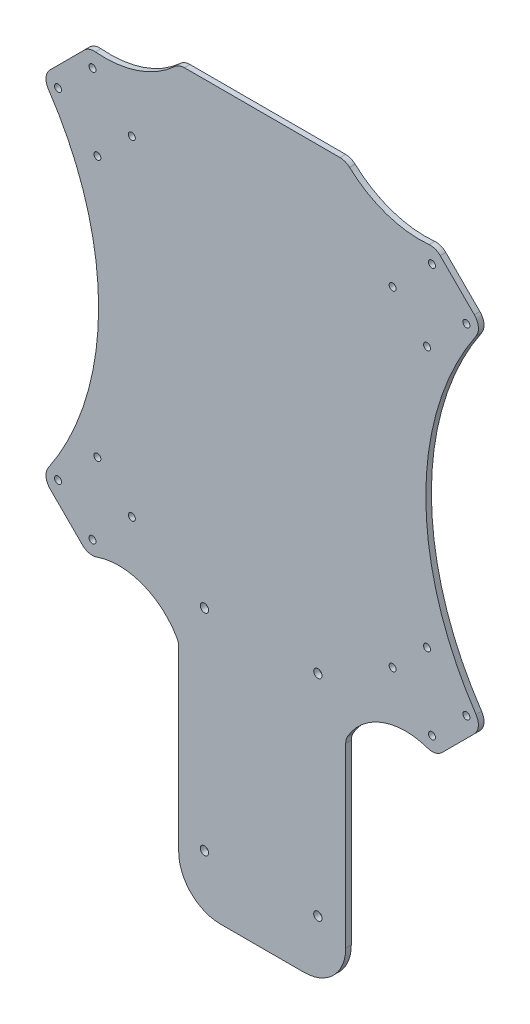
from build123d import *

# Parameters (mm, degrees)
BOSS_EXTRUDE1_DEPTH = 2
SKETCH3_R           = 1.25
F_45_DEGREES_DEPTH  = 188.552659272
SKETCH4_R           = 1.5
CUT_EXTRUDE2_DEPTH  = 188.552659272
FILLET1_R           = 5
FILLET2_R           = 5
FILLET3_R           = 5
FILLET4_R           = 5
FILLET5_R           = 5
FILLET6_R           = 5
FILLET7_R           = 5
FILLET8_R           = 5
FILLET9_R           = 5
FILLET10_R          = 5
FILLET11_R          = 5
FILLET12_R          = 5


with BuildPart() as part:
    # Sketch2 → Boss-Extrude1 (new body)
    with BuildSketch(Plane.XY):
        with BuildLine():
            Line((-79.195959493, 62.225396744), (-62.225396744, 79.195959493))
            ThreePointArc((-62.225396744, 79.195959493), (-44.806778225, 80.702789346), (-30, 90))
            Line((-30, 90), (30, 90))
            ThreePointArc((30, 90), (44.806778225, 80.702789346), (62.225396744, 79.195959493))
            Line((62.225396744, 79.195959493), (79.195959493, 62.225396744))
            ThreePointArc((79.195959493, 62.225396744), (58.781303002, 0), (79.195959493, -62.225396744))
            Line((79.195959493, -62.225396744), (62.225396744, -79.195959493))
            ThreePointArc((62.225396744, -79.195959493), (43.875108319, -77.923881554), (30, -90))
            Line((30, -90), (30, -155))
            ThreePointArc((30, -155), (25.606601718, -165.606601718), (15, -170))
            Line((15, -170), (-15, -170))
            ThreePointArc((-15, -170), (-25.606601718, -165.606601718), (-30, -155))
            Line((-30, -155), (-30, -90))
            ThreePointArc((-30, -90), (-43.875108319, -77.923881554), (-62.225396744, -79.195959493))
            Line((-62.225396744, -79.195959493), (-79.195959493, -62.225396744))
            ThreePointArc((-79.195959493, -62.225396744), (-58.781303002, 0), (-79.195959493, 62.225396744))
        make_face()
    extrude(amount=BOSS_EXTRUDE1_DEPTH)

    # Sketch3 → 45 Degrees (cut, through all)
    with BuildSketch(Plane.XY.offset(2)):
        with Locations((-73.362328548, 60.987959877)):
            Circle(SKETCH3_R)
        with Locations((-59.220192924, 46.845824254)):
            Circle(SKETCH3_R)
        with Locations(Location((-60.987959877, 73.362328548, 0), (0, 0, 180))):
            Circle(SKETCH3_R)
        with Locations(Location((-46.845824254, 59.220192924, 0), (0, 0, 180))):
            Circle(SKETCH3_R)
        with Locations(Location((59.220192924, 46.845824254, 0), (0, 0, 180))):
            Circle(SKETCH3_R)
        with Locations(Location((73.362328548, 60.987959877, 0), (0, 0, 180))):
            Circle(SKETCH3_R)
        with Locations((60.987959877, 73.362328548)):
            Circle(SKETCH3_R)
        with Locations((46.845824254, 59.220192924)):
            Circle(SKETCH3_R)
        with Locations(Location((-59.220192924, -46.845824254, 0), (0, 0, 180))):
            Circle(SKETCH3_R)
        with Locations((-46.845824254, -59.220192924)):
            Circle(SKETCH3_R)
        with Locations((-60.987959877, -73.362328548)):
            Circle(SKETCH3_R)
        with Locations(Location((-73.362328548, -60.987959877, 0), (0, 0, 180))):
            Circle(SKETCH3_R)
        with Locations((59.220192924, -46.845824254)):
            Circle(SKETCH3_R)
        with Locations((73.362328548, -60.987959877)):
            Circle(SKETCH3_R)
        with Locations(Location((60.987959877, -73.362328548, 0), (0, 0, 180))):
            Circle(SKETCH3_R)
        with Locations(Location((46.845824254, -59.220192924, 0), (0, 0, 180))):
            Circle(SKETCH3_R)
    extrude(amount=-F_45_DEGREES_DEPTH, mode=Mode.SUBTRACT)

    # Sketch4 → Cut-Extrude2 (cut, through all)
    with BuildSketch(Plane.XY.offset(2)):
        with Locations((-20.76, -150)):
            Circle(SKETCH4_R)
        with Locations((20, -150)):
            Circle(SKETCH4_R)
        with Locations((-20.76, -74.5)):
            Circle(SKETCH4_R)
        with Locations((20, -74.5)):
            Circle(SKETCH4_R)
    extrude(amount=-CUT_EXTRUDE2_DEPTH, mode=Mode.SUBTRACT)

    # Fillet1
    fillet1_edges = [part.edges().sort_by_distance(p)[0] for p in [
        (-30, -90, 1),
    ]]
    fillet(fillet1_edges, radius=FILLET1_R)

    # Fillet2
    fillet2_edges = [part.edges().sort_by_distance(p)[0] for p in [
        (-62.225396744, -79.195959493, 1),
    ]]
    fillet(fillet2_edges, radius=FILLET2_R)

    # Fillet3
    fillet3_edges = [part.edges().sort_by_distance(p)[0] for p in [
        (30, -90, 1),
    ]]
    fillet(fillet3_edges, radius=FILLET3_R)

    # Fillet4
    fillet4_edges = [part.edges().sort_by_distance(p)[0] for p in [
        (62.225396744, -79.195959493, 1),
    ]]
    fillet(fillet4_edges, radius=FILLET4_R)

    # Fillet5
    fillet5_edges = [part.edges().sort_by_distance(p)[0] for p in [
        (79.195959493, -62.225396744, 1),
    ]]
    fillet(fillet5_edges, radius=FILLET5_R)

    # Fillet6
    fillet6_edges = [part.edges().sort_by_distance(p)[0] for p in [
        (-79.195959493, -62.225396744, 1),
    ]]
    fillet(fillet6_edges, radius=FILLET6_R)

    # Fillet7
    fillet7_edges = [part.edges().sort_by_distance(p)[0] for p in [
        (-79.195959493, 62.225396744, 1),
    ]]
    fillet(fillet7_edges, radius=FILLET7_R)

    # Fillet8
    fillet8_edges = [part.edges().sort_by_distance(p)[0] for p in [
        (-62.225396744, 79.195959493, 1),
    ]]
    fillet(fillet8_edges, radius=FILLET8_R)

    # Fillet9
    fillet9_edges = [part.edges().sort_by_distance(p)[0] for p in [
        (-30, 90, 1),
    ]]
    fillet(fillet9_edges, radius=FILLET9_R)

    # Fillet10
    fillet10_edges = [part.edges().sort_by_distance(p)[0] for p in [
        (30, 90, 1),
    ]]
    fillet(fillet10_edges, radius=FILLET10_R)

    # Fillet11
    fillet11_edges = [part.edges().sort_by_distance(p)[0] for p in [
        (62.225396744, 79.195959493, 1),
    ]]
    fillet(fillet11_edges, radius=FILLET11_R)

    # Fillet12
    fillet12_edges = [part.edges().sort_by_distance(p)[0] for p in [
        (79.195959493, 62.225396744, 1),
    ]]
    fillet(fillet12_edges, radius=FILLET12_R)


solid = part.part
